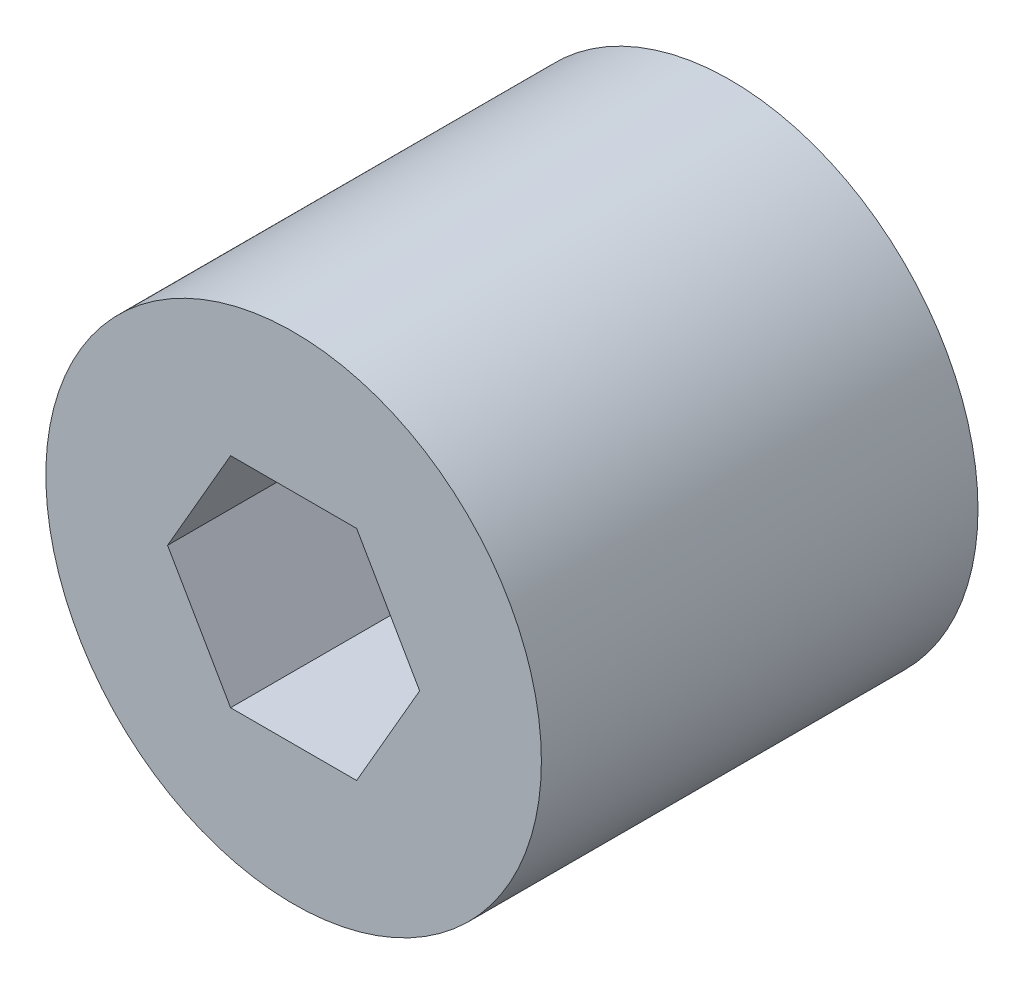
from build123d import *

# Parameters (mm, degrees)
SKETCH2_R           = 14.4145
BOSS_EXTRUDE1_DEPTH = 25.4


with BuildPart() as part:
    # Sketch2 → Boss-Extrude1 (new body)
    with BuildSketch(Plane.XY):
        Circle(SKETCH2_R)
        Polygon((-3.666174209, 6.35), (-7.332348419, 0), (-3.666174209, -6.35), (3.666174209, -6.35), (7.332348419, 0), (3.666174209, 6.35), align=None, mode=Mode.SUBTRACT)
    extrude(amount=-BOSS_EXTRUDE1_DEPTH)


solid = part.part
